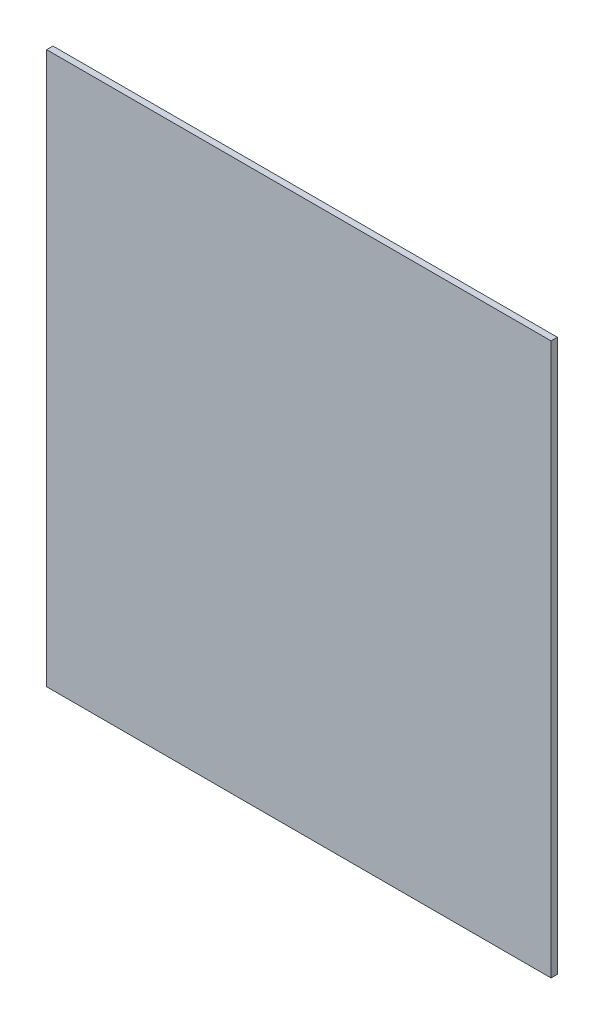
from build123d import *

# Parameters (mm, degrees)
SKETCH1_W           = 64
SKETCH1_H           = 70
BOSS_EXTRUDE1_DEPTH = 0.8


with BuildPart() as part:
    # Sketch1 → Boss-Extrude1 (new body)
    with BuildSketch(Plane.XY):
        with Locations((-20.208808224, -18.5)):
            Rectangle(SKETCH1_W, SKETCH1_H)
    extrude(amount=BOSS_EXTRUDE1_DEPTH)


solid = part.part
